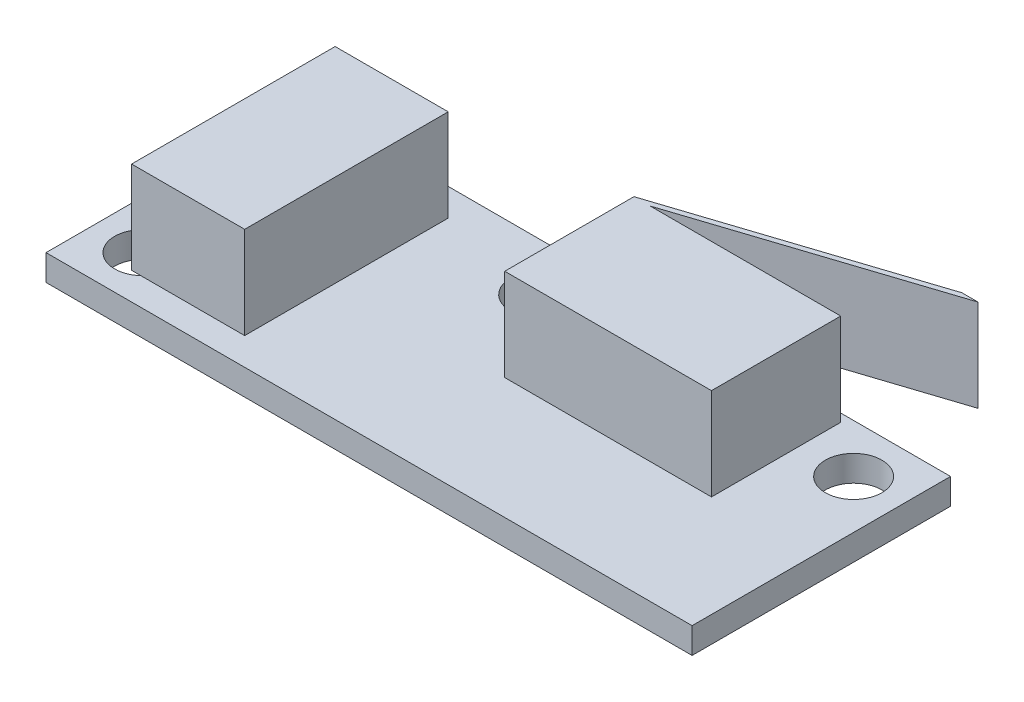
from build123d import *

# Parameters (mm, degrees)
SKETCH1_W           = 40
SKETCH1_H           = 16
BOSS_EXTRUDE1_DEPTH = 1.6
SKETCH2_R           = 1.75
CUT_EXTRUDE1_DEPTH  = 1.6
BOSS_EXTRUDE2_DEPTH = 5.7
SKETCH4_W           = 7
SKETCH4_H           = 12.6
BOSS_EXTRUDE3_DEPTH = 5.7


with BuildPart() as part:
    # Sketch1 → Boss-Extrude1 (new body)
    with BuildSketch(Plane(origin=(0, 0, 0), x_dir=(1, 0, 0), z_dir=(0, 1, 0))):
        Rectangle(SKETCH1_W, SKETCH1_H)
    extrude(amount=BOSS_EXTRUDE1_DEPTH)

    # Sketch2 → Cut-Extrude1 (cut)
    with BuildSketch(Plane(origin=(0, 0, 0), x_dir=(1, 0, 0), z_dir=(0, 1, 0))):
        with Locations(Location((-17, 5, 0), (0, 0, 270))):
            Circle(SKETCH2_R)
        with Locations(Location((-17, -5, 0), (0, 0, 270))):
            Circle(SKETCH2_R)
        with Locations(Location((-2.5, 5, 0), (0, 0, 270))):
            Circle(SKETCH2_R)
        with Locations(Location((17, 5, 0), (0, 0, 270))):
            Circle(SKETCH2_R)
    extrude(amount=CUT_EXTRUDE1_DEPTH, mode=Mode.SUBTRACT)

    # Sketch3 → Boss-Extrude2 (add)
    with BuildSketch(Plane(origin=(0, 1.6, 0), x_dir=(1, 0, 0), z_dir=(0, 1, 0))):
        Polygon((0.9, 7.5), (16.2, 12.5), (17.2, 12.5), (1.9, 7.5), (13.7, 7.5), (13.7, -0.5), (0.9, -0.5), align=None)
    extrude(amount=BOSS_EXTRUDE2_DEPTH)

    # Sketch4 → Boss-Extrude3 (add)
    with BuildSketch(Plane(origin=(0, 1.6, 0), x_dir=(1, 0, 0), z_dir=(0, 1, 0))):
        with Locations((-12.9, 0)):
            Rectangle(SKETCH4_W, SKETCH4_H)
    extrude(amount=BOSS_EXTRUDE3_DEPTH)


solid = part.part
